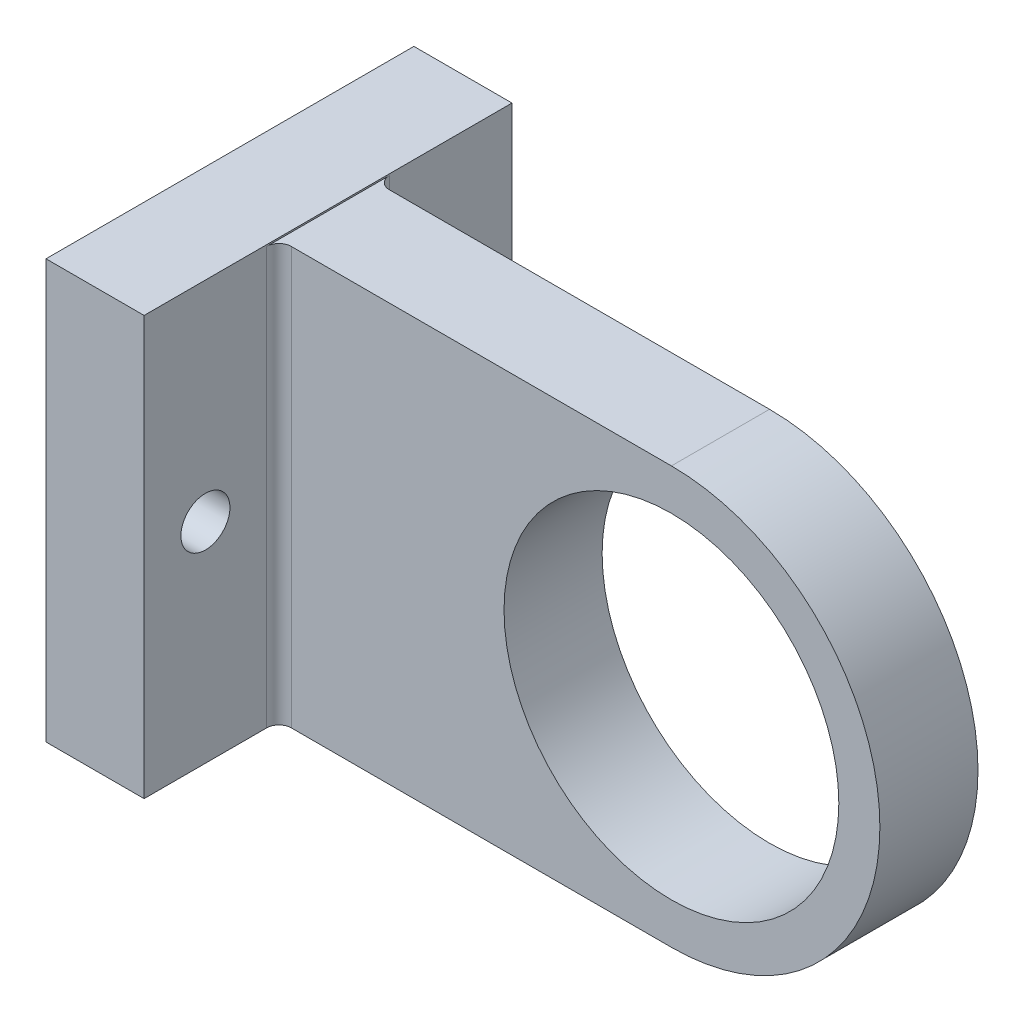
from build123d import *

# Parameters (mm, degrees)
SKETCH2_R           = 13.65
BOSS_EXTRUDE1_DEPTH = 8
SKETCH3_W           = 30
SKETCH3_H           = 34.126910457
BOSS_EXTRUDE2_DEPTH = 8
FILLET1_R           = 1
SKETCH5_R           = 2
CUT_EXTRUDE2_DEPTH  = 63.689475997


with BuildPart() as part:
    # Sketch2 → Boss-Extrude1 (new body)
    with BuildSketch(Plane.XY):
        with BuildLine():
            Line((22.912878475, 16.112283523), (-17.087121525, 16.112283523))
            Line((-17.087121525, 16.112283523), (-17.087121525, -17.887716477))
            Line((-17.087121525, -17.887716477), (22.912878475, -17.887716477))
            ThreePointArc((22.912878475, -17.887716477), (39.912878475, -0.887716477), (22.912878475, 16.112283523))
        make_face()
        with Locations((22.912878475, -0.887716477)):
            Circle(SKETCH2_R, mode=Mode.SUBTRACT)
    extrude(amount=BOSS_EXTRUDE1_DEPTH)

    # Sketch3 → Boss-Extrude2 (add)
    with BuildSketch(Plane.ZY.offset(17.087121525)):
        with Locations((4, -0.824261249)):
            Rectangle(SKETCH3_W, SKETCH3_H)
    extrude(amount=-BOSS_EXTRUDE2_DEPTH)

    # Fillet1
    fillet1_edges = [part.edges().sort_by_distance(p)[0] for p in [
        (-9.087121525, -0.887716477, 8),
        (-9.087121525, -0.887716477, 0),
    ]]
    fillet(fillet1_edges, radius=FILLET1_R)

    # Sketch5 → Cut-Extrude2 (cut, through all)
    with BuildSketch(Plane.ZY.offset(17.087121525)):
        with Locations(Location((-6, -0.824261249, 0), (0, 0, 270))):
            Circle(SKETCH5_R)
        with Locations(Location((14, -0.824261249, 0), (0, 0, 270))):
            Circle(SKETCH5_R)
    extrude(amount=-CUT_EXTRUDE2_DEPTH, mode=Mode.SUBTRACT)


solid = part.part
